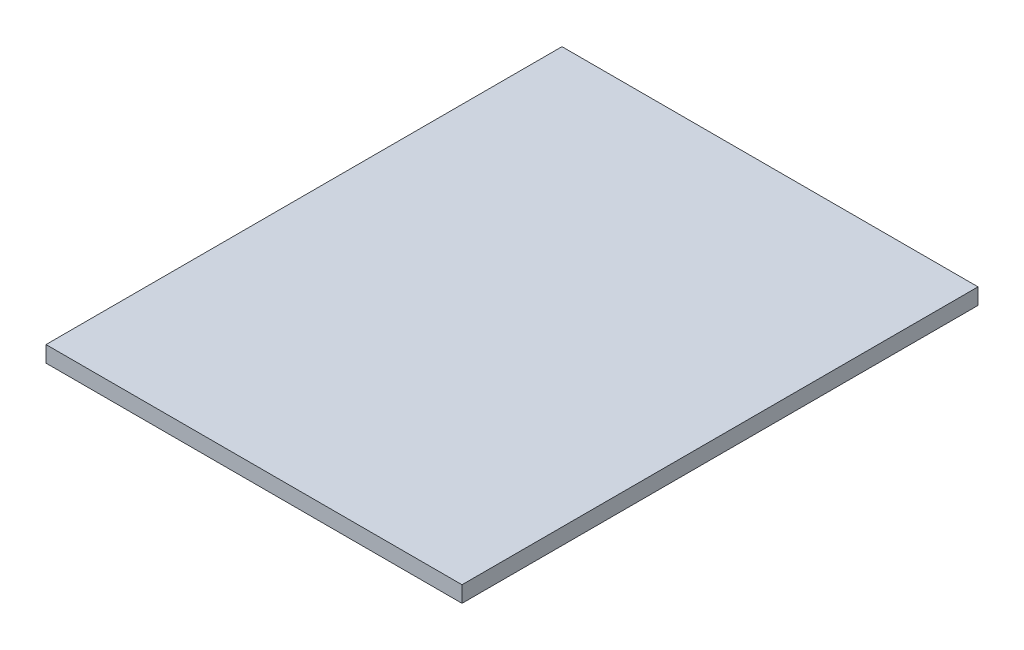
from build123d import *

# Parameters (mm, degrees)
SKETCH1_W           = 327.66
SKETCH1_H           = 406.4
BOSS_EXTRUDE1_DEPTH = 12.7


with BuildPart() as part:
    # Sketch1 → Boss-Extrude1 (new body)
    with BuildSketch(Plane(origin=(0, 0, 0), x_dir=(1, 0, 0), z_dir=(0, 1, 0))):
        Rectangle(SKETCH1_W, SKETCH1_H)
    extrude(amount=BOSS_EXTRUDE1_DEPTH)


solid = part.part
